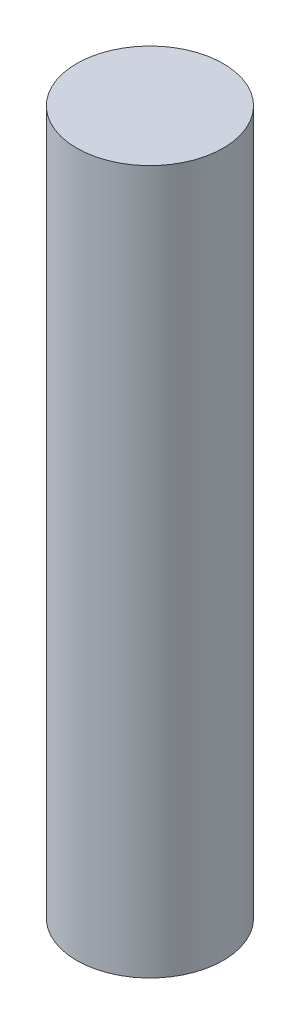
from build123d import *

# Parameters (mm, degrees)
SKETCH_1_R      = 2.5
EXTRUDE_1_DEPTH = 24


with BuildPart() as part:
    # 草图1 → 凸台-拉伸1 (new body)
    with BuildSketch(Plane(origin=(0, 0, 0), x_dir=(1, 0, 0), z_dir=(0, 1, 0))):
        with Locations(Location((0, 0, 0), (0, 0, 270))):
            Circle(SKETCH_1_R)
    extrude(amount=EXTRUDE_1_DEPTH)


solid = part.part
